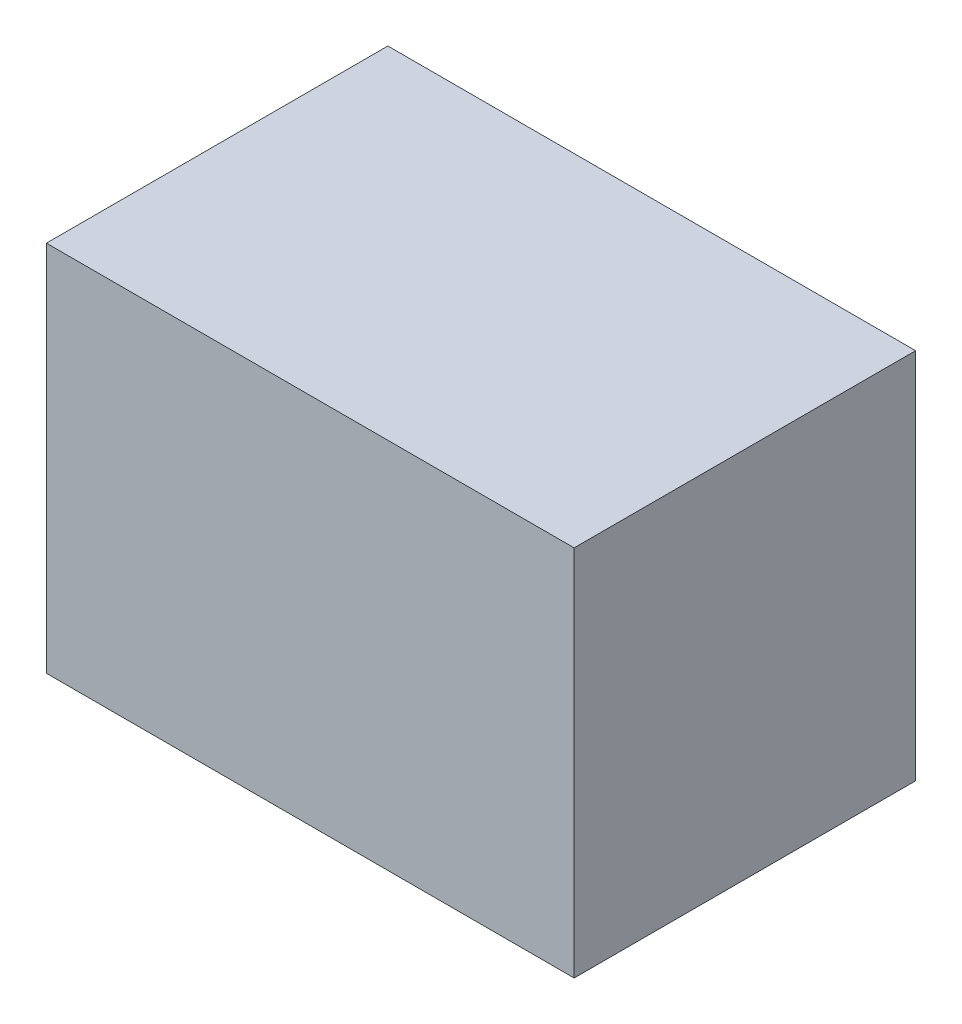
from build123d import *

# Parameters (mm, degrees)
SKETCH1_W           = 53.975
SKETCH1_H           = 34.925
BOSS_EXTRUDE1_DEPTH = 38.1


with BuildPart() as part:
    # Sketch1 → Boss-Extrude1 (new body)
    with BuildSketch(Plane(origin=(0, 0, 0), x_dir=(1, 0, 0), z_dir=(0, 1, 0))):
        Rectangle(SKETCH1_W, SKETCH1_H)
    extrude(amount=BOSS_EXTRUDE1_DEPTH)


solid = part.part
